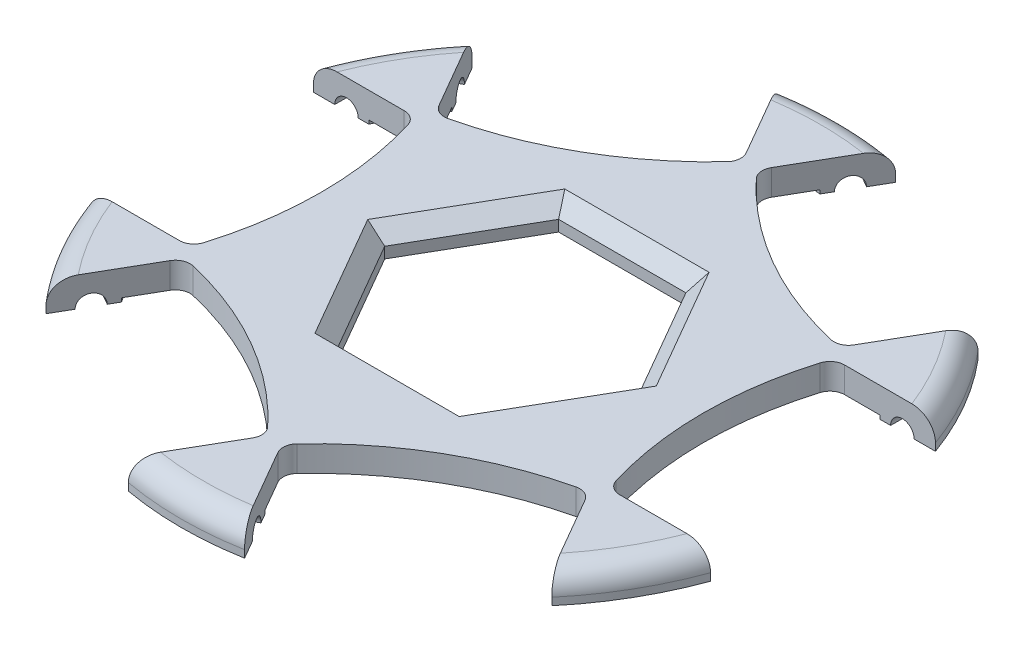
from build123d import *

# Parameters (mm, degrees)
SKIZZE1_R                       = 45
AUFSATZ_LINEAR_AUSTRAGEN1_DEPTH = 4
SCHNITT_LINEAR_START            = -10
SCHNITT_LINEAR_AUSTRAGEN2_DEPTH = 10
KREISMUSTER1_COUNT              = 6
SCHNITT_LINEAR_AUSTRAGEN3_DEPTH = 10
VERRUNDUNG1_R                   = 2
SKIZZE5_R                       = 1.6
SCHNITT_LINEAR_AUSTRAGEN5_DEPTH = 3.8
VERRUNDUNG4_R                   = 0.5
KREISMUSTER2_COUNT              = 6
VERRUNDUNG4_OF_KREISMUSTER2_R   = 0.5
SCHNITT_LINEAR_START_2          = -3.8
SKIZZE6_R                       = 1.6
SCHNITT_LINEAR_AUSTRAGEN6_DEPTH = 3.8
VERRUNDUNG3_R                   = 0.5
KREISMUSTER3_COUNT              = 6
VERRUNDUNG3_OF_KREISMUSTER3_R   = 0.5
SKIZZE7_R                       = 38
SCHNITT_LINEAR_AUSTRAGEN7_DEPTH = 0.5
FASE1_SIZE                      = 2
VERRUNDUNG2_R                   = 3


with BuildPart() as part:
    # Skizze1 → Aufsatz-Linear austragen1 (new body)
    with BuildSketch(Plane(origin=(0, 0, 0), x_dir=(1, 0, 0), z_dir=(0, 1, 0))):
        with Locations(Location((0, 0, 0), (0, 0, 270))):
            Circle(SKIZZE1_R)
    extrude(amount=AUFSATZ_LINEAR_AUSTRAGEN1_DEPTH)

    # Skizze2 → Schnitt-Linear austragen2 (cut)
    with BuildSketch(Plane(origin=(0, 4, 0), x_dir=(1, 0, 0), z_dir=(0, 1, 0)).offset(SCHNITT_LINEAR_START)):
        with BuildLine():
            ThreePointArc((-26, 0), (-26.63006939, 7.751752964), (-28.503736417, 15.3))
            Line((-28.503736417, 15.3), (-42.319144604, 15.3))
            ThreePointArc((-42.319144604, 15.3), (-45, 0), (-42.319144604, -15.3))
            Line((-42.319144604, -15.3), (-28.503736417, -15.3))
            ThreePointArc((-28.503736417, -15.3), (-26.63006939, -7.751752964), (-26, 0))
        make_face()
    schnitt_linear_austragen2 = extrude(amount=SCHNITT_LINEAR_AUSTRAGEN2_DEPTH, mode=Mode.SUBTRACT)

    # Kreismuster1: Schnitt-Linear austragen2 ×6 about axis
    kreismuster1_axis = Axis((0, 0, 0), (0, 1, 0))
    for i in range(1, KREISMUSTER1_COUNT):
        add(schnitt_linear_austragen2.rotate(kreismuster1_axis, i * 360 / KREISMUSTER1_COUNT), mode=Mode.SUBTRACT)

    # Skizze3 → Schnitt-Linear austragen3 (cut)
    with BuildSketch(Plane.XZ):
        Polygon((17.320508076, 0), (8.660254038, 15), (-8.660254038, 15), (-17.320508076, 0), (-8.660254038, -15), (8.660254038, -15), align=None)
    extrude(amount=-SCHNITT_LINEAR_AUSTRAGEN3_DEPTH, mode=Mode.SUBTRACT)

    # Verrundung1
    verrundung1_edges = [part.edges().sort_by_distance(p)[0] for p in [
        (-28.503736417, 2, 15.3),
        (-28.503736417, 2, -15.3),
        (-27.502056886, 2, -17.03495984),
        (-1.001679531, 2, -32.33495984),
        (1.001679531, 2, -32.33495984),
        (27.502056886, 2, -17.03495984),
        (28.503736417, 2, -15.3),
        (28.503736417, 2, 15.3),
        (27.502056886, 2, 17.03495984),
        (1.001679531, 2, 32.33495984),
        (-1.001679531, 2, 32.33495984),
        (-27.502056886, 2, 17.03495984),
    ]]
    fillet(verrundung1_edges, radius=VERRUNDUNG1_R)

    # Skizze5 → Schnitt-Linear austragen5 (cut)
    with BuildSketch(Plane(origin=(13.250188678, 0, 7.65), x_dir=(-0.4999999999999918, 0, 0.8660254037844434), z_dir=(-0.8660254037844434, 0, -0.4999999999999918))):
        with Locations((-37.819144604, 0)):
            Circle(SKIZZE5_R)
    schnitt_linear_austragen5 = extrude(amount=-SCHNITT_LINEAR_AUSTRAGEN5_DEPTH, mode=Mode.SUBTRACT)

    # Verrundung4
    verrundung4_edges = [part.edges().sort_by_distance(p)[0] for p in [
        (35.450657514, 0, -23.202339976),
    ]]
    fillet(verrundung4_edges, radius=VERRUNDUNG4_R)

    # Kreismuster2: Schnitt-Linear austragen5 ×6 about axis
    kreismuster2_axis = Axis((0, 0, 0), (0, 1, 0))
    for i in range(1, KREISMUSTER2_COUNT):
        add(schnitt_linear_austragen5.rotate(kreismuster2_axis, i * 360 / KREISMUSTER2_COUNT), mode=Mode.SUBTRACT)

    # Verrundung4 of Kreismuster2
    verrundung4_of_kreismuster2_edges = [part.edges().sort_by_distance(p)[0] for p in [
        (-2.36848709, 0, -42.302339976),
        (-37.819144604, 0, -19.1),
        (-35.450657514, 0, 23.202339976),
        (2.36848709, 0, 42.302339976),
        (37.819144604, 0, 19.1),
    ]]
    fillet(verrundung4_of_kreismuster2_edges, radius=VERRUNDUNG4_OF_KREISMUSTER2_R)

    # Skizze6 → Schnitt-Linear austragen6 (cut)
    with BuildSketch(Plane.XY.offset(-15.3).offset(SCHNITT_LINEAR_START_2)):
        with Locations((37.819144604, 0)):
            Circle(SKIZZE6_R)
    schnitt_linear_austragen6 = extrude(amount=SCHNITT_LINEAR_AUSTRAGEN6_DEPTH, mode=Mode.SUBTRACT)

    # Verrundung3
    verrundung3_edges = [part.edges().sort_by_distance(p)[0] for p in [
        (37.819144604, 1.6, -19.1),
    ]]
    fillet(verrundung3_edges, radius=VERRUNDUNG3_R)

    # Kreismuster3: Schnitt-Linear austragen6 ×6 about axis
    kreismuster3_axis = Axis((0, 0, 0), (0, 1, 0))
    for i in range(1, KREISMUSTER3_COUNT):
        add(schnitt_linear_austragen6.rotate(kreismuster3_axis, i * 360 / KREISMUSTER3_COUNT), mode=Mode.SUBTRACT)

    # Verrundung3 of Kreismuster3
    verrundung3_of_kreismuster3_edges = [part.edges().sort_by_distance(p)[0] for p in [
        (2.36848709, 1.6, -42.302339976),
        (-35.450657514, 1.6, -23.202339976),
        (-37.819144604, 1.6, 19.1),
        (-2.36848709, 1.6, 42.302339976),
        (35.450657514, 1.6, 23.202339976),
    ]]
    fillet(verrundung3_of_kreismuster3_edges, radius=VERRUNDUNG3_OF_KREISMUSTER3_R)

    # Skizze7 → Schnitt-Linear austragen7 (cut)
    with BuildSketch(Plane.XZ):
        Circle(SKIZZE7_R)
    extrude(amount=-SCHNITT_LINEAR_AUSTRAGEN7_DEPTH, mode=Mode.SUBTRACT)

    # Fase1
    fase1_edges = [part.edges().sort_by_distance(p)[0] for p in [
        (12.990381057, 4, -7.5),
        (0, 4, -15),
        (-12.990381057, 4, -7.5),
        (-12.990381057, 4, 7.5),
        (0, 4, 15),
        (12.990381057, 4, 7.5),
    ]]
    chamfer(fase1_edges, length=FASE1_SIZE)

    # Verrundung2
    verrundung2_edges = [part.edges().sort_by_distance(p)[0] for p in [
        (0, 4, 45),
        (38.97114317, 4, 22.5),
        (38.97114317, 4, -22.5),
        (0, 4, -45),
        (-38.97114317, 4, -22.5),
        (-38.97114317, 4, 22.5),
    ]]
    fillet(verrundung2_edges, radius=VERRUNDUNG2_R)


solid = part.part
